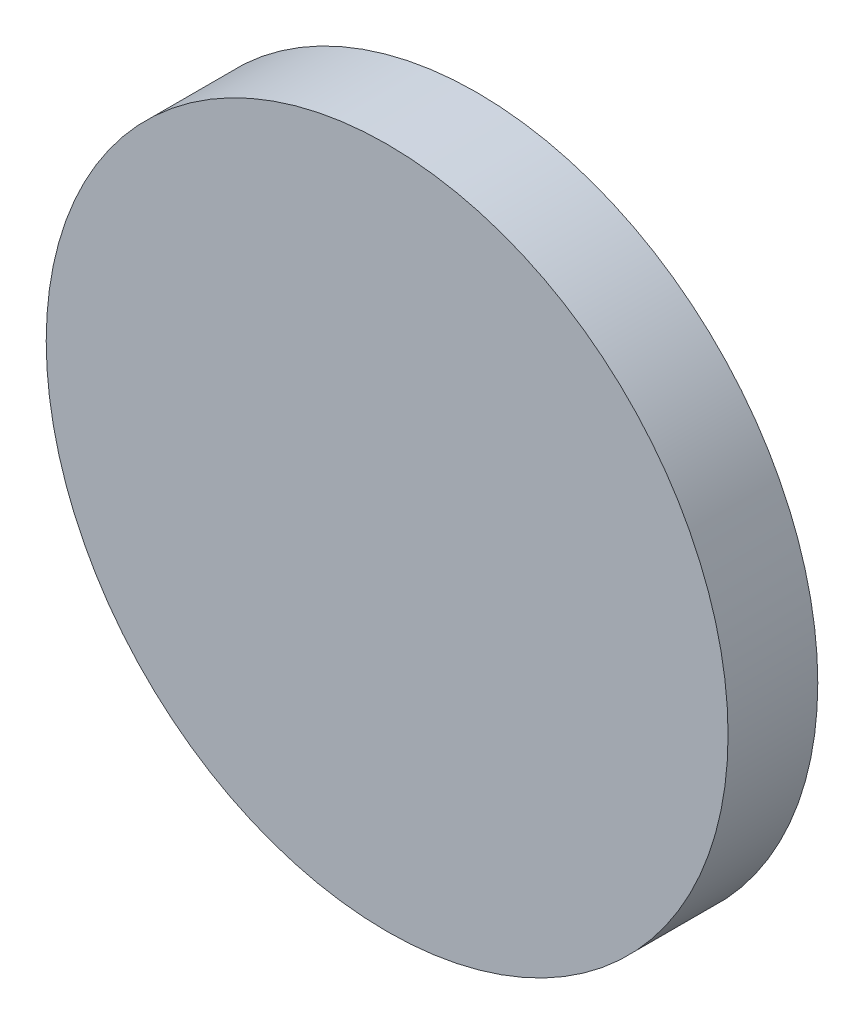
from build123d import *

# Parameters (mm, degrees)
SKETCH1_R           = 19
BOSS_EXTRUDE1_DEPTH = 5


with BuildPart() as part:
    # Sketch1 → Boss-Extrude1 (new body)
    with BuildSketch(Plane.XY):
        Circle(SKETCH1_R)
    extrude(amount=BOSS_EXTRUDE1_DEPTH)

    # Sketch3 → Revolve1 (revolve)
    with BuildSketch(Plane(origin=(0, 0, 0), x_dir=(1, 0, 0), z_dir=(0, 1, 0))):
        with BuildLine():
            Line((-16.5, 6.5), (-16.5, 0))
            Line((-16.5, 0), (-14.5, 0))
            Line((-14.5, 0), (-14.5, 8.5))
            ThreePointArc((-14.5, 8.5), (-15.914213562, 7.914213562), (-16.5, 6.5))
        make_face()
    revolve(axis=Axis((-14.5, 0, -6.5), (0, 0, 1)))


solid = part.part
